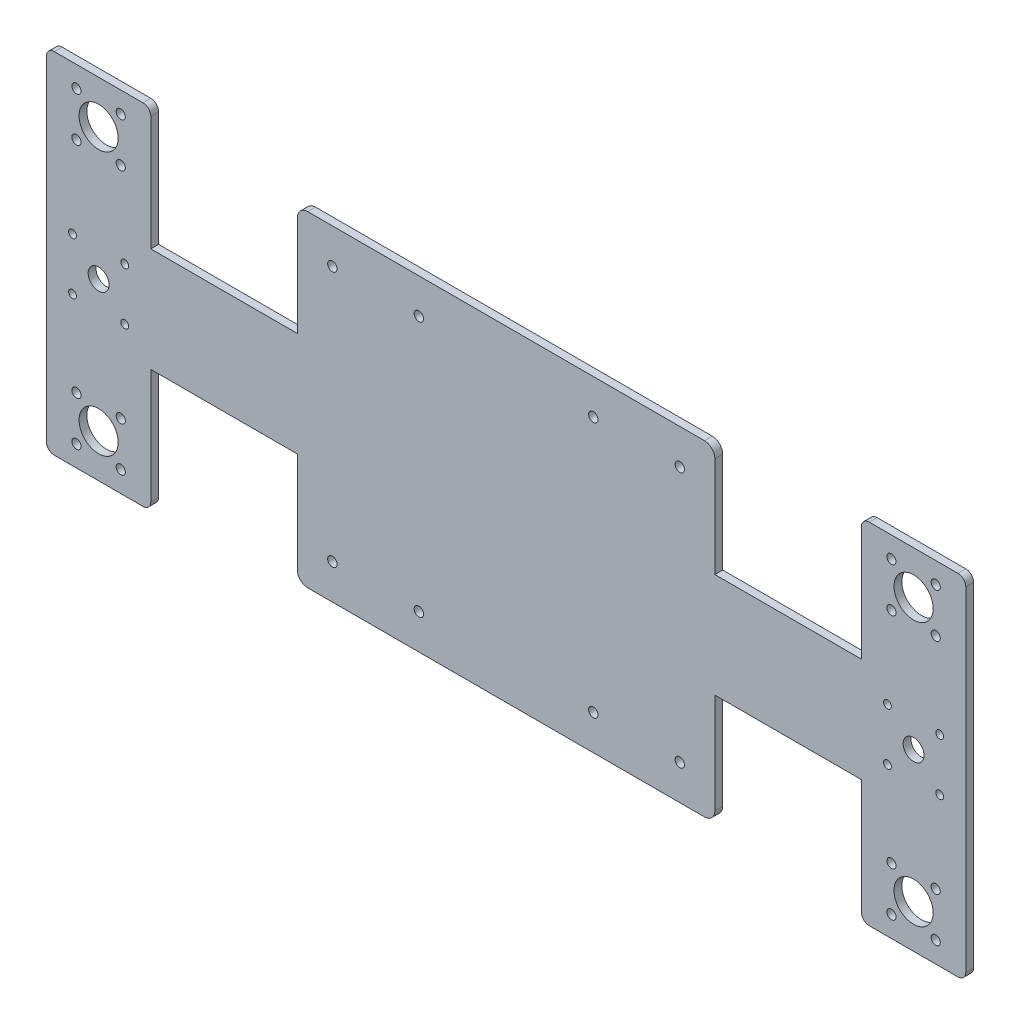
from build123d import *

# Parameters (mm, degrees)
SKETCH_1_R      = 1.5
SKETCH_1_W      = 272.3
SKETCH_1_H      = 40
EXTRUDE_1_DEPTH = 3
FILLET_1_R      = 7
SKETCH_2_W      = 13.425
SKETCH_2_H      = 40
SKETCH_2_W_2    = 33.15
SKETCH_2_W_3    = 66.85
EXTRUDE_2_DEPTH = 3
FILLET_2_R      = 4
SKETCH_3_R      = 1.75
SKETCH_3_R_2    = 7.5
EXTRUDE_3_DEPTH = 3
FILLET_3_R      = 3
FILLET_5_R      = 3


with BuildPart() as part:
    # 스케치1 → 보스-돌출1 (new body)
    # profile 1 of 5: a face of its own
    with BuildSketch(Plane.XY):
        with BuildLine():
            Line((156.15, -4), (156.15, -20))
            Line((156.15, -20), (176.15, -20))
            Line((176.15, -20), (176.15, 20))
            Line((176.15, 20), (156.15, 20))
            Line((156.15, 20), (156.15, 4))
            ThreePointArc((156.15, 4), (158.978427125, 2.828427125), (160.15, 0))
            ThreePointArc((160.15, 0), (158.978427125, -2.828427125), (156.15, -4))
        make_face()
        with Locations((166.15, -10)):
            Circle(SKETCH_1_R, mode=Mode.SUBTRACT)
        with Locations((166.15, 10)):
            Circle(SKETCH_1_R, mode=Mode.SUBTRACT)
    # profile 2 of 5: a face of its own
    with BuildSketch(Plane.XY):
        with BuildLine():
            Line((136.15, 20), (136.15, -20))
            Line((136.15, -20), (156.15, -20))
            Line((156.15, -20), (156.15, -4))
            ThreePointArc((156.15, -4), (152.15, 0), (156.15, 4))
            Line((156.15, 4), (156.15, 20))
            Line((156.15, 20), (136.15, 20))
        make_face()
        with Locations((146.15, -10)):
            Circle(SKETCH_1_R, mode=Mode.SUBTRACT)
        with Locations((146.15, 10)):
            Circle(SKETCH_1_R, mode=Mode.SUBTRACT)
    # profile 3 of 5: a face of its own
    with BuildSketch(Plane.XY):
        Rectangle(SKETCH_1_W, SKETCH_1_H)
    # profile 4 of 5: a face of its own
    with BuildSketch(Plane.XY):
        with BuildLine():
            Line((-176.15, -20), (-156.15, -20))
            Line((-156.15, -20), (-156.15, -4))
            ThreePointArc((-156.15, -4), (-160.15, 0), (-156.15, 4))
            Line((-156.15, 4), (-156.15, 20))
            Line((-156.15, 20), (-176.15, 20))
            Line((-176.15, 20), (-176.15, -20))
        make_face()
        with Locations((-166.15, -10)):
            Circle(SKETCH_1_R, mode=Mode.SUBTRACT)
        with Locations((-166.15, 10)):
            Circle(SKETCH_1_R, mode=Mode.SUBTRACT)
    # profile 5 of 5: a face of its own
    with BuildSketch(Plane.XY):
        with BuildLine():
            Line((-156.15, -4), (-156.15, -20))
            Line((-156.15, -20), (-136.15, -20))
            Line((-136.15, -20), (-136.15, 20))
            Line((-136.15, 20), (-156.15, 20))
            Line((-156.15, 20), (-156.15, 4))
            ThreePointArc((-156.15, 4), (-153.321572875, 2.828427125), (-152.15, 0))
            ThreePointArc((-152.15, 0), (-153.321572875, -2.828427125), (-156.15, -4))
        make_face()
        with Locations((-146.15, -10)):
            Circle(SKETCH_1_R, mode=Mode.SUBTRACT)
        with Locations((-146.15, 10)):
            Circle(SKETCH_1_R, mode=Mode.SUBTRACT)
    extrude(amount=EXTRUDE_1_DEPTH)

    # 필렛1
    fillet_1_edges = [part.edges().sort_by_distance(p)[0] for p in [
        (176.15, 20, 1.5),
        (176.15, -20, 1.5),
        (-176.15, -20, 1.5),
        (-176.15, 20, 1.5),
    ]]
    fillet(fillet_1_edges, radius=FILLET_1_R)

    # 스케치2 → 보스-돌출2 (add)
    with BuildSketch(Plane.XY.offset(3)):
        with BuildLine():
            Line((-80, 62.43), (-80, 20))
            Line((-80, 20), (-66.575, 20))
            Line((-66.575, 20), (-66.575, 47.2))
            ThreePointArc((-66.575, 47.2), (-67.847792206, 50.272792206), (-64.775, 49))
            Line((-64.775, 49), (-35.225, 49))
            ThreePointArc((-35.225, 49), (-33.425, 50.8), (-31.625, 49))
            Line((-31.625, 49), (31.625, 49))
            ThreePointArc((31.625, 49), (33.425, 50.8), (35.225, 49))
            Line((35.225, 49), (64.775, 49))
            ThreePointArc((64.775, 49), (66.575, 50.8), (68.375, 49))
            ThreePointArc((68.375, 49), (67.847792206, 47.727207794), (66.575, 47.2))
            Line((66.575, 47.2), (66.575, 20))
            Line((66.575, 20), (80, 20))
            Line((80, 20), (80, 62.43))
            Line((80, 62.43), (-80, 62.43))
        make_face()
        with Locations((-73.2875, 0)):
            Rectangle(SKETCH_2_W, SKETCH_2_H)
        with BuildLine():
            Line((-80, -20), (-80, -62.43))
            Line((-80, -62.43), (80, -62.43))
            Line((80, -62.43), (80, -20))
            Line((80, -20), (66.575, -20))
            Line((66.575, -20), (66.575, -47.2))
            ThreePointArc((66.575, -47.2), (67.847792206, -47.727207794), (68.375, -49))
            ThreePointArc((68.375, -49), (66.575, -50.8), (64.775, -49))
            Line((64.775, -49), (35.225, -49))
            ThreePointArc((35.225, -49), (33.425, -50.8), (31.625, -49))
            Line((31.625, -49), (-31.625, -49))
            ThreePointArc((-31.625, -49), (-33.425, -50.8), (-35.225, -49))
            Line((-35.225, -49), (-64.775, -49))
            ThreePointArc((-64.775, -49), (-67.847792206, -50.272792206), (-66.575, -47.2))
            Line((-66.575, -47.2), (-66.575, -20))
            Line((-66.575, -20), (-80, -20))
        make_face()
        with Locations((-50, 0)):
            Rectangle(SKETCH_2_W_2, SKETCH_2_H)
        with BuildLine():
            Line((-66.575, 47.2), (-66.575, 20))
            Line((-66.575, 20), (-33.425, 20))
            Line((-33.425, 20), (-33.425, 47.2))
            ThreePointArc((-33.425, 47.2), (-34.697792206, 47.727207794), (-35.225, 49))
            Line((-35.225, 49), (-64.775, 49))
            ThreePointArc((-64.775, 49), (-65.302207794, 47.727207794), (-66.575, 47.2))
        make_face()
        with BuildLine():
            Line((-33.425, 47.2), (-33.425, 20))
            Line((-33.425, 20), (33.425, 20))
            Line((33.425, 20), (33.425, 47.2))
            ThreePointArc((33.425, 47.2), (32.152207794, 47.727207794), (31.625, 49))
            Line((31.625, 49), (-31.625, 49))
            ThreePointArc((-31.625, 49), (-32.152207794, 47.727207794), (-33.425, 47.2))
        make_face()
        Rectangle(SKETCH_2_W_3, SKETCH_2_H)
        with Locations((50, 0)):
            Rectangle(SKETCH_2_W_2, SKETCH_2_H)
        with BuildLine():
            Line((33.425, 20), (66.575, 20))
            Line((66.575, 20), (66.575, 47.2))
            ThreePointArc((66.575, 47.2), (65.302207794, 47.727207794), (64.775, 49))
            Line((64.775, 49), (35.225, 49))
            ThreePointArc((35.225, 49), (34.697792206, 47.727207794), (33.425, 47.2))
            Line((33.425, 47.2), (33.425, 20))
        make_face()
        with BuildLine():
            Line((66.575, -47.2), (66.575, -20))
            Line((66.575, -20), (33.425, -20))
            Line((33.425, -20), (33.425, -47.2))
            ThreePointArc((33.425, -47.2), (34.697792206, -47.727207794), (35.225, -49))
            Line((35.225, -49), (64.775, -49))
            ThreePointArc((64.775, -49), (65.302207794, -47.727207794), (66.575, -47.2))
        make_face()
        with BuildLine():
            Line((-33.425, -20), (-66.575, -20))
            Line((-66.575, -20), (-66.575, -47.2))
            ThreePointArc((-66.575, -47.2), (-65.302207794, -47.727207794), (-64.775, -49))
            Line((-64.775, -49), (-35.225, -49))
            ThreePointArc((-35.225, -49), (-34.697792206, -47.727207794), (-33.425, -47.2))
            Line((-33.425, -47.2), (-33.425, -20))
        make_face()
        with BuildLine():
            Line((33.425, -20), (-33.425, -20))
            Line((-33.425, -20), (-33.425, -47.2))
            ThreePointArc((-33.425, -47.2), (-32.152207794, -47.727207794), (-31.625, -49))
            Line((-31.625, -49), (31.625, -49))
            ThreePointArc((31.625, -49), (32.152207794, -47.727207794), (33.425, -47.2))
            Line((33.425, -47.2), (33.425, -20))
        make_face()
    extrude(amount=-EXTRUDE_2_DEPTH)

    # 필렛2
    fillet_2_edges = [part.edges().sort_by_distance(p)[0] for p in [
        (80, -62.43, 1.5),
        (-80, -62.43, 1.5),
        (-80, 62.43, 1.5),
        (80, 62.43, 1.5),
    ]]
    fillet(fillet_2_edges, radius=FILLET_2_R)

    # 스케치3 → 보스-돌출3 (add)
    # profile 1 of 2: a face of its own
    with BuildSketch(Plane.XY.offset(3)):
        with BuildLine():
            Line((-176.15, -13), (-176.15, -66.970562748))
            Line((-176.15, -66.970562748), (-136.15, -66.970562748))
            Line((-136.15, -66.970562748), (-136.15, -20))
            Line((-136.15, -20), (-169.15, -20))
            ThreePointArc((-169.15, -20), (-174.099747468, -17.949747468), (-176.15, -13))
        make_face()
        with Locations((-164.635281374, -42)):
            Circle(SKETCH_3_R, mode=Mode.SUBTRACT)
        with Locations((-147.664718626, -42)):
            Circle(SKETCH_3_R, mode=Mode.SUBTRACT)
        with Locations((-147.664718626, -58.970562748)):
            Circle(SKETCH_3_R, mode=Mode.SUBTRACT)
        with Locations((-164.635281374, -58.970562748)):
            Circle(SKETCH_3_R, mode=Mode.SUBTRACT)
        with Locations((-156.15, -50.485281374)):
            Circle(SKETCH_3_R_2, mode=Mode.SUBTRACT)
    # profile 2 of 2: a face of its own
    with BuildSketch(Plane.XY.offset(3)):
        with BuildLine():
            Line((-176.15, 66.970562748), (-176.15, 13))
            ThreePointArc((-176.15, 13), (-174.099747468, 17.949747468), (-169.15, 20))
            Line((-169.15, 20), (-136.15, 20))
            Line((-136.15, 20), (-136.15, 66.970562748))
            Line((-136.15, 66.970562748), (-176.15, 66.970562748))
        make_face()
        with Locations((-164.635281374, 42)):
            Circle(SKETCH_3_R, mode=Mode.SUBTRACT)
        with Locations((-147.664718626, 42)):
            Circle(SKETCH_3_R, mode=Mode.SUBTRACT)
        with Locations((-156.15, 50.485281374)):
            Circle(SKETCH_3_R_2, mode=Mode.SUBTRACT)
        with Locations((-164.635281374, 58.970562748)):
            Circle(SKETCH_3_R, mode=Mode.SUBTRACT)
        with Locations((-147.664718626, 58.970562748)):
            Circle(SKETCH_3_R, mode=Mode.SUBTRACT)
    extrude_3 = extrude(amount=-EXTRUDE_3_DEPTH)

    # 필렛3
    fillet_3_edges = [part.edges().sort_by_distance(p)[0] for p in [
        (-176.15, 66.970562748, 1.5),
        (-136.15, 66.970562748, 1.5),
        (-136.15, -66.970562748, 1.5),
        (-176.15, -66.970562748, 1.5),
    ]]
    fillet(fillet_3_edges, radius=FILLET_3_R)

    # 대칭 복사1: 보스-돌출3 across plane
    add(extrude_3.mirror(Plane(origin=(0, 0, 0), x_dir=(0, 0, 1), z_dir=(1, 0, 0))))

    # 필렛5
    fillet_5_edges = [part.edges().sort_by_distance(p)[0] for p in [
        (136.15, 66.970562748, 1.5),
        (176.15, 66.970562748, 1.5),
        (176.15, -66.970562748, 1.5),
        (136.15, -66.970562748, 1.5),
    ]]
    fillet(fillet_5_edges, radius=FILLET_5_R)


solid = part.part
